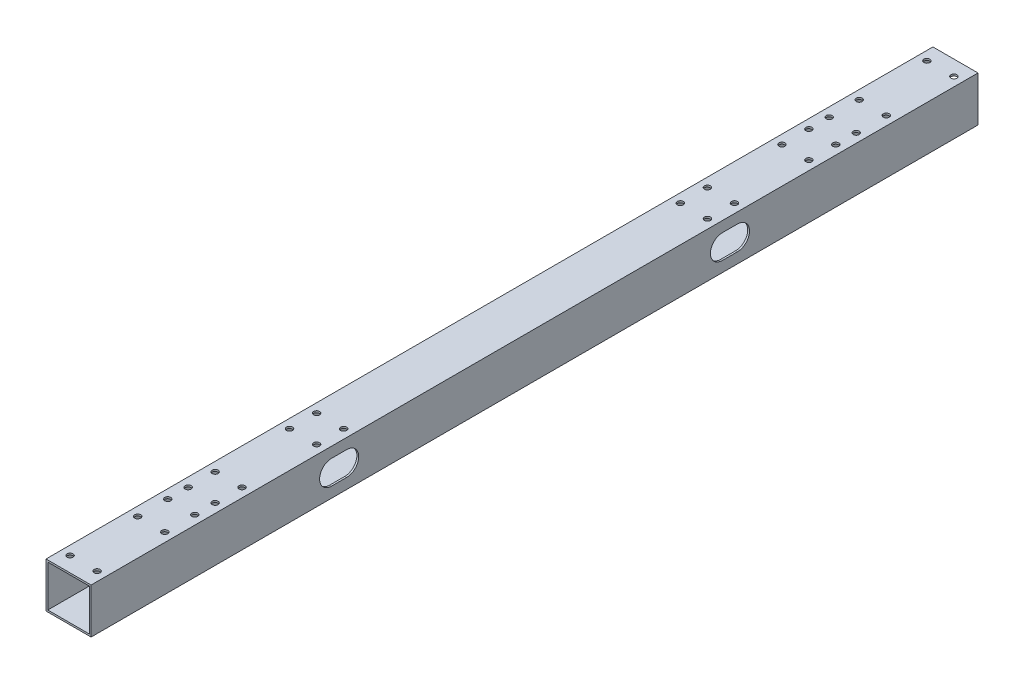
from build123d import *

# Parameters (mm, degrees)
SKETCH_1_W          = 30
SKETCH_1_H          = 30
SKETCH_1_W_2        = 27.6
SKETCH_1_H_2        = 27.6
EXTRUDE_1_DEPTH     = 295
SKETCH_2_R          = 2
CUT_EXTRUDE_1_DEPTH = 10
SKETCH_3_R          = 4
CUT_EXTRUDE_2_DEPTH = 10
CUT_EXTRUDE_3_DEPTH = 111
SKETCH_5_R          = 2
CUT_EXTRUDE_4_DEPTH = 10
SKETCH_6_R          = 2
CUT_EXTRUDE_5_DEPTH = 10
SKETCH_7_R          = 1.5
CUT_EXTRUDE_6_DEPTH = 10
SKETCH_8_R          = 2
CUT_EXTRUDE_7_DEPTH = 46
SKETCH_9_R          = 4
CUT_EXTRUDE_8_DEPTH = 5


with BuildPart() as part:
    # 草图1 → 凸台-拉伸1 (new, symmetric)
    with BuildSketch(Plane.XY):
        Rectangle(SKETCH_1_W, SKETCH_1_H)
        Rectangle(SKETCH_1_W_2, SKETCH_1_H_2, mode=Mode.SUBTRACT)
    extrude(amount=EXTRUDE_1_DEPTH, both=True)

    # 草图2 → 切除-拉伸1 (cut)
    with BuildSketch(Plane(origin=(0, 15, 0), x_dir=(1, 0, 0), z_dir=(0, 1, 0))):
        with Locations(Location((-9, 220, 0), (0, 0, 270))):
            Circle(SKETCH_2_R)
        with Locations(Location((9, 220, 0), (0, 0, 270))):
            Circle(SKETCH_2_R)
        with Locations(Location((-9, 240, 0), (0, 0, 270))):
            Circle(SKETCH_2_R)
        with Locations(Location((9, 240, 0), (0, 0, 270))):
            Circle(SKETCH_2_R)
        with Locations((9, -240)):
            Circle(SKETCH_2_R)
        with Locations((-9, -240)):
            Circle(SKETCH_2_R)
        with Locations((9, -220)):
            Circle(SKETCH_2_R)
        with Locations((-9, -220)):
            Circle(SKETCH_2_R)
    extrude(amount=-CUT_EXTRUDE_1_DEPTH, mode=Mode.SUBTRACT)

    # 草图3 → 切除-拉伸2 (cut)
    with BuildSketch(Plane(origin=(0, -13.8, 0), x_dir=(1, 0, 0), z_dir=(0, 1, 0))):
        with Locations(Location((-9, 240, 0), (0, 0, 270))):
            Circle(SKETCH_3_R)
        with Locations(Location((9, 240, 0), (0, 0, 270))):
            Circle(SKETCH_3_R)
        with Locations(Location((-9, 220, 0), (0, 0, 270))):
            Circle(SKETCH_3_R)
        with Locations(Location((9, 220, 0), (0, 0, 270))):
            Circle(SKETCH_3_R)
        with Locations(Location((9, -220, 0), (0, 0, 270))):
            Circle(SKETCH_3_R)
        with Locations(Location((-9, -220, 0), (0, 0, 270))):
            Circle(SKETCH_3_R)
        with Locations(Location((9, -240, 0), (0, 0, 270))):
            Circle(SKETCH_3_R)
        with Locations(Location((-9, -240, 0), (0, 0, 270))):
            Circle(SKETCH_3_R)
    extrude(amount=-CUT_EXTRUDE_2_DEPTH, mode=Mode.SUBTRACT)

    # 草图4 → 切除-拉伸3 (cut)
    with BuildSketch(Plane(origin=(15, 0, 0), x_dir=(0, 0, -1), z_dir=(1, 0, 0))):
        with BuildLine():
            Line((-135, 8), (-125, 8))
            ThreePointArc((-125, 8), (-117, 0), (-125, -8))
            Line((-125, -8), (-135, -8))
            ThreePointArc((-135, -8), (-143, 0), (-135, 8))
        make_face()
    cut_extrude_3 = extrude(amount=-CUT_EXTRUDE_3_DEPTH, mode=Mode.SUBTRACT)

    # 镜向1: 切除-拉伸3 across plane
    add(cut_extrude_3.mirror(Plane.XY), mode=Mode.SUBTRACT)

    # 草图5 → 切除-拉伸4 (cut)
    with BuildSketch(Plane(origin=(0, 15, 0), x_dir=(1, 0, 0), z_dir=(0, 1, 0))):
        with Locations(Location((-9, -139, 0), (0, 0, 270))):
            Circle(SKETCH_5_R)
        with Locations(Location((-9, -121, 0), (0, 0, 270))):
            Circle(SKETCH_5_R)
        with Locations(Location((9, -121, 0), (0, 0, 270))):
            Circle(SKETCH_5_R)
        with Locations(Location((9, -139, 0), (0, 0, 270))):
            Circle(SKETCH_5_R)
    cut_extrude_4 = extrude(amount=-CUT_EXTRUDE_4_DEPTH, mode=Mode.SUBTRACT)

    # 镜向2: 切除-拉伸4 across plane
    add(cut_extrude_4.mirror(Plane.XY), mode=Mode.SUBTRACT)

    # 草图6 → 切除-拉伸5 (cut)
    with BuildSketch(Plane(origin=(0, 15, 0), x_dir=(1, 0, 0), z_dir=(0, 1, 0))):
        with Locations(Location((-9, -285, 0), (0, 0, 270))):
            Circle(SKETCH_6_R)
        with Locations(Location((9, -285, 0), (0, 0, 270))):
            Circle(SKETCH_6_R)
    cut_extrude_5 = extrude(amount=-CUT_EXTRUDE_5_DEPTH, mode=Mode.SUBTRACT)

    # 镜向3: 切除-拉伸5 across plane
    add(cut_extrude_5.mirror(Plane.XY), mode=Mode.SUBTRACT)

    # 草图7 → 切除-拉伸6 (cut)
    with BuildSketch(Plane.XZ.offset(15)):
        with Locations(Location((0, 98.738437042, 0), (0, 0, 270))):
            Circle(SKETCH_7_R)
        with Locations(Location((0, 38.738437042, 0), (0, 0, 270))):
            Circle(SKETCH_7_R)
        with Locations(Location((0, -38.738437042, 0), (0, 0, 270))):
            Circle(SKETCH_7_R)
        with Locations(Location((0, -98.738437042, 0), (0, 0, 270))):
            Circle(SKETCH_7_R)
    extrude(amount=-CUT_EXTRUDE_6_DEPTH, mode=Mode.SUBTRACT)

    # 草图8 → 切除-拉伸7 (cut, symmetric)
    with BuildSketch(Plane.XZ.offset(-13.8)):
        with Locations((8.95, 206.45)):
            Circle(SKETCH_8_R)
        with Locations((-8.95, 206.45)):
            Circle(SKETCH_8_R)
        with Locations((-8.95, 188.55)):
            Circle(SKETCH_8_R)
        with Locations((8.95, 188.55)):
            Circle(SKETCH_8_R)
    cut_extrude_7 = extrude(amount=CUT_EXTRUDE_7_DEPTH, both=True, mode=Mode.SUBTRACT)

    # 镜向4: 切除-拉伸7 across plane
    add(cut_extrude_7.mirror(Plane.XY), mode=Mode.SUBTRACT)

    # 草图9 → 切除-拉伸8 (cut, symmetric)
    with BuildSketch(Plane.XZ.offset(15)):
        with Locations(Location((-8.95, 206.45, 0), (0, 0, 90))):
            Circle(SKETCH_9_R)
        with Locations(Location((8.95, 206.45, 0), (0, 0, 90))):
            Circle(SKETCH_9_R)
        with Locations(Location((8.95, 188.55, 0), (0, 0, 90))):
            Circle(SKETCH_9_R)
        with Locations(Location((-8.95, 188.55, 0), (0, 0, 90))):
            Circle(SKETCH_9_R)
        with Locations(Location((-8.95, -188.55, 0), (0, 0, 90))):
            Circle(SKETCH_9_R)
        with Locations(Location((8.95, -188.55, 0), (0, 0, 90))):
            Circle(SKETCH_9_R)
        with Locations(Location((8.95, -206.45, 0), (0, 0, 90))):
            Circle(SKETCH_9_R)
        with Locations(Location((-8.95, -206.45, 0), (0, 0, 90))):
            Circle(SKETCH_9_R)
    extrude(amount=CUT_EXTRUDE_8_DEPTH, both=True, mode=Mode.SUBTRACT)


solid = part.part
